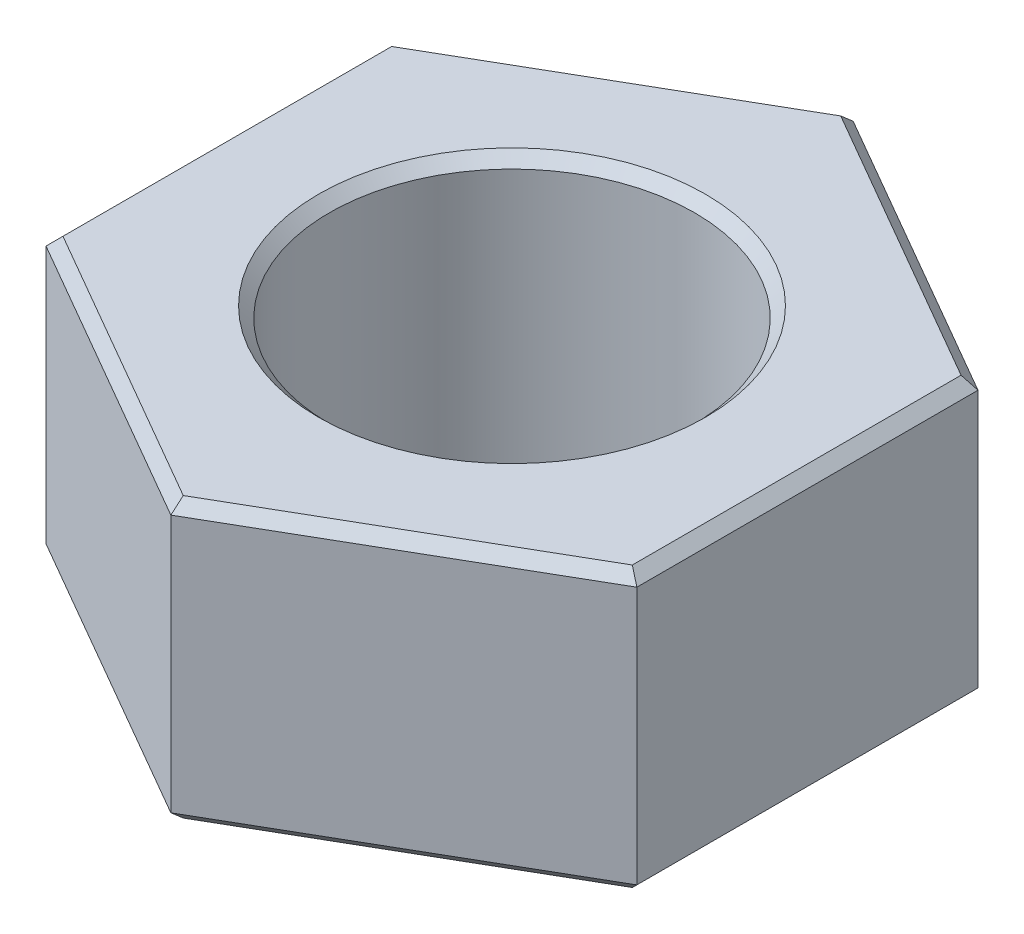
from build123d import *

# Parameters (mm, degrees)
SKETCH_1_R      = 17
EXTRUDE_1_DEPTH = 26
CHAMFER_1_SIZE  = 1


with BuildPart() as part:
    # Эскиз1 → Бобышка-Вытянуть1 (new body)
    with BuildSketch(Plane(origin=(0, 0, 0), x_dir=(1, 0, 0), z_dir=(0, 1, 0))):
        Polygon((0, 31.754264805), (-27.5, 15.877132403), (-27.5, -15.877132403), (0, -31.754264805), (27.5, -15.877132403), (27.5, 15.877132403), align=None)
        with Locations(Location((0, 0, 0), (0, 0, 90))):
            Circle(SKETCH_1_R, mode=Mode.SUBTRACT)
    extrude(amount=EXTRUDE_1_DEPTH)

    # Фаска1
    chamfer_1_edges = [part.edges().sort_by_distance(p)[0] for p in [
        (-27.5, 26, 0),
        (-13.75, 26, 23.815698604),
        (0, 0, 17),
        (0, 26, 17),
        (13.75, 26, 23.815698604),
        (27.5, 26, 0),
        (13.75, 26, -23.815698604),
        (27.5, 0, 0),
        (13.75, 0, 23.815698604),
        (-13.75, 0, 23.815698604),
        (-27.5, 0, 0),
        (-13.75, 0, -23.815698604),
        (13.75, 0, -23.815698604),
        (-13.75, 26, -23.815698604),
    ]]
    chamfer(chamfer_1_edges, length=CHAMFER_1_SIZE)


solid = part.part
